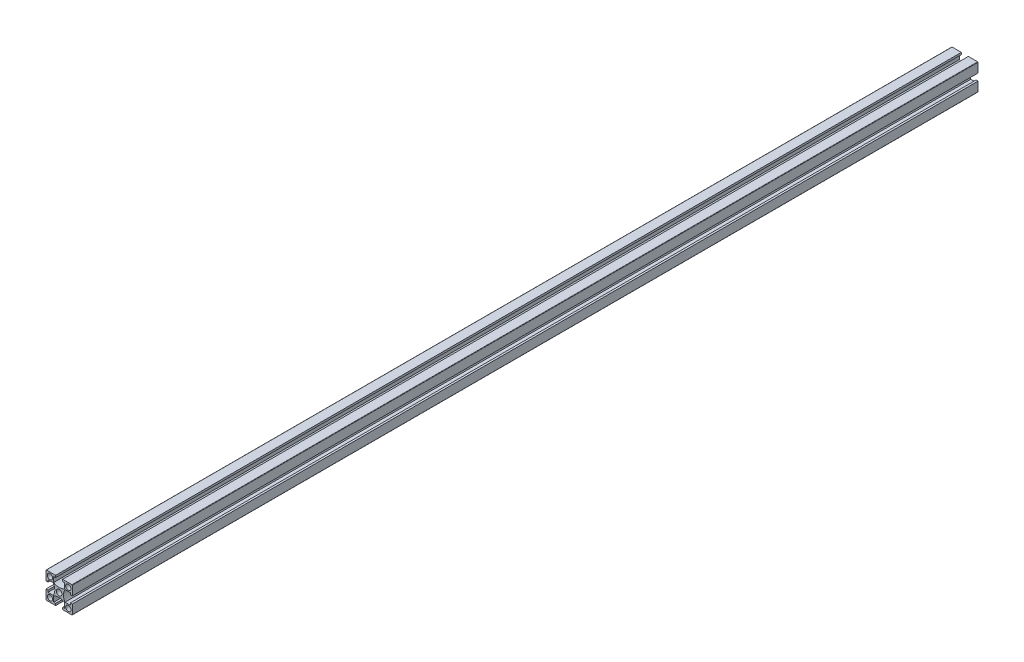
from build123d import *

# Parameters (mm, degrees)
SKETCH_1_W               = 20
SKETCH_1_H               = 20
SKETCH_1_R               = 2
SKETCH_1_R_2             = 2.15
EXTRUDE_1_DEPTH          = 690
CUT_EXTRUDE_1_REACH      = 692.145
PATTERN_CIRCULAR_1_COUNT = 4
FILLET_1_R               = 0.3


with BuildPart() as part:
    # 스케치1 → 보스-돌출1 (new body)
    with BuildSketch(Plane.XY):
        Rectangle(SKETCH_1_W, SKETCH_1_H)
        with Locations((-7, -7)):
            Circle(SKETCH_1_R, mode=Mode.SUBTRACT)
        with Locations((7, -7)):
            Circle(SKETCH_1_R, mode=Mode.SUBTRACT)
        with Locations((-7, 7)):
            Circle(SKETCH_1_R, mode=Mode.SUBTRACT)
        Circle(SKETCH_1_R_2, mode=Mode.SUBTRACT)
        with Locations((7, 7)):
            Circle(SKETCH_1_R, mode=Mode.SUBTRACT)
    extrude(amount=EXTRUDE_1_DEPTH)

    # 스케치1<3> → 컷-돌출1 (cut, up to next)
    with BuildSketch(Plane.XY, mode=Mode.PRIVATE) as cut_extrude_1_sk1:
        with BuildLine():
            Line((-8.5, 2.65), (-10, 2.65))
            Line((-10, 2.65), (-10, -2.65))
            Line((-10, -2.65), (-8.5, -2.65))
            Line((-8.5, -2.65), (-8.5, -4.15))
            Line((-8.5, -4.15), (-4.503166667, -4.15))
            ThreePointArc((-4.503166667, -4.15), (-3.3, 0), (-4.503166667, 4.15))
            Line((-4.503166667, 4.15), (-8.5, 4.15))
            Line((-8.5, 4.15), (-8.5, 2.65))
        make_face()
    cut_extrude_1_tool1 = extrude(cut_extrude_1_sk1.sketch, amount=CUT_EXTRUDE_1_REACH, mode=Mode.PRIVATE) & part.part
    cut_extrude_1 = cut_extrude_1_tool1.solids().sort_by_distance((-6.606913, 0, 0))[0]
    add(cut_extrude_1, mode=Mode.SUBTRACT)

    # 원형 패턴1: 컷-돌출1 ×4 about axis
    pattern_circular_1_axis = Axis((0, 0, 690), (0, 0, -1))
    for i in range(1, PATTERN_CIRCULAR_1_COUNT):
        add(cut_extrude_1.rotate(pattern_circular_1_axis, i * 360 / PATTERN_CIRCULAR_1_COUNT), mode=Mode.SUBTRACT)

    # 필렛1
    fillet_1_edges = [part.edges().sort_by_distance(p)[0] for p in [
        (10, -10, 345),
        (-10, -10, 345),
        (-10, 10, 345),
        (10, 10, 345),
    ]]
    fillet(fillet_1_edges, radius=FILLET_1_R)


solid = part.part
